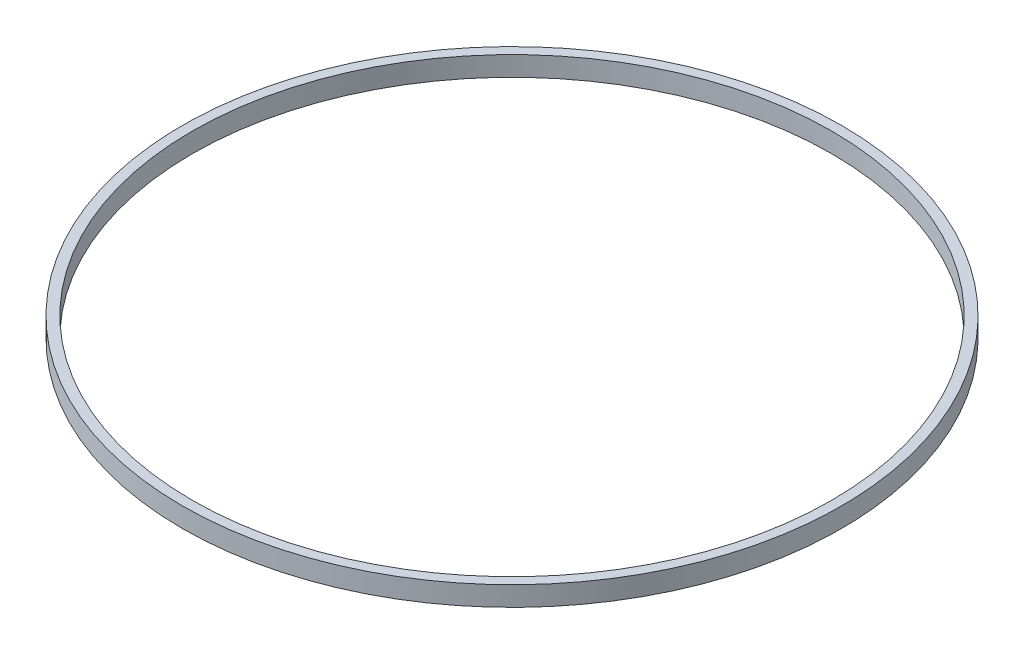
from build123d import *

# Parameters (mm, degrees)
SKETCH1_R           = 67.1
SKETCH1_R_2         = 65.1
BOSS_EXTRUDE2_DEPTH = 4


with BuildPart() as part:
    # Sketch1 → Boss-Extrude2 (new body)
    with BuildSketch(Plane(origin=(0, 0, 0), x_dir=(1, 0, 0), z_dir=(0, 1, 0))):
        with Locations(Location((0, 0, 0), (0, 0, 270))):
            Circle(SKETCH1_R)
        with Locations(Location((0, 0, 0), (0, 0, 270))):
            Circle(SKETCH1_R_2, mode=Mode.SUBTRACT)
    extrude(amount=BOSS_EXTRUDE2_DEPTH)


solid = part.part
